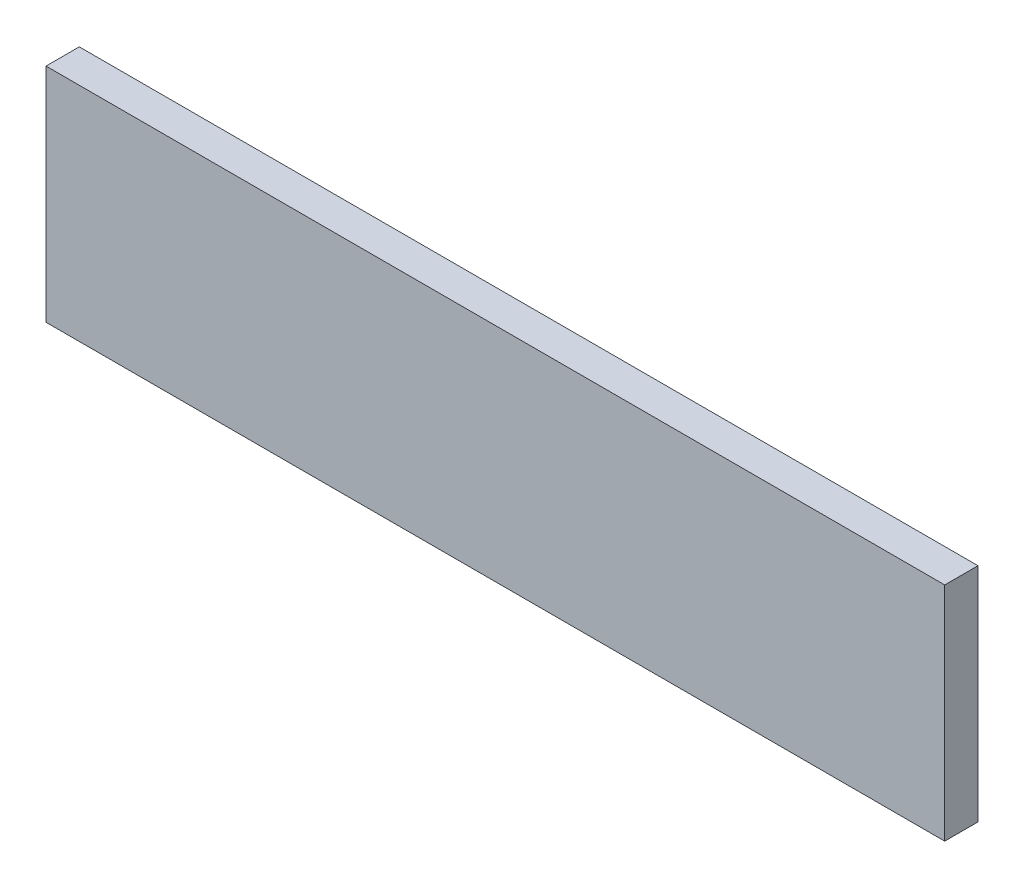
from build123d import *

# Parameters (mm, degrees)
SKETCH1_W           = 514.35
SKETCH1_H           = 127
BOSS_EXTRUDE1_DEPTH = 19.05


with BuildPart() as part:
    # Sketch1 → Boss-Extrude1 (new body)
    with BuildSketch(Plane.XY):
        with Locations((257.175, 63.5)):
            Rectangle(SKETCH1_W, SKETCH1_H)
    extrude(amount=BOSS_EXTRUDE1_DEPTH)


solid = part.part
